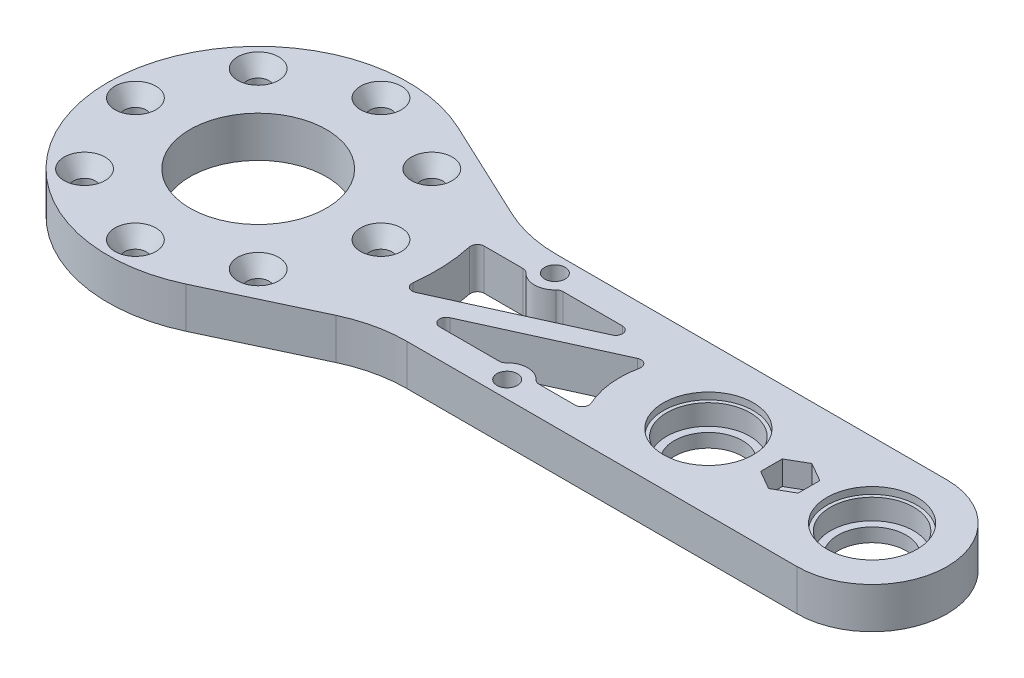
from build123d import *

# Parameters (mm, degrees)
SKETCH_1_R               = 1.6
SKETCH_1_R_2             = 10
SKETCH_1_R_3             = 5
EXTRUDE_1_DEPTH          = 6
FILLET_1_R               = 20
FILLET_2_R               = 1
CUT_EXTRUDE_START        = -6
SKETCH_2_R               = 6.6
CUT_EXTRUDE_2_DEPTH      = 5
SKETCH_3_R               = 1.5
CUT_EXTRUDE_3_DEPTH      = 34
EXTRUDE_2_DEPTH          = 6
FILLET_3_R               = 20
EXTRUDE_4_DEPTH          = 6
FILLET_5_R               = 1
EXTRUDE_5_DEPTH          = 6
FILLET_6_R               = 1
SKETCH_7_R               = 6.6
SKETCH_7_R_2             = 5
EXTRUDE_6_DEPTH          = 5
SKETCH_8_R               = 6.6
CUT_EXTRUDE_4_DEPTH      = 1
SKETCH_9_R               = 6.1
CUT_EXTRUDE_5_DEPTH      = 3
CUT_EXTRUDE_6_DEPTH      = 3.5
SKETCH_11_R              = 1.5
CUT_EXTRUDE_7_DEPTH      = 3.5
PATTERN_CIRCULAR_1_COUNT = 8


with BuildPart() as part:
    # 草图1 → 凸台-拉伸1 (new body)
    with BuildSketch(Plane(origin=(0, 0, 0), x_dir=(1, 0, 0), z_dir=(0, 1, 0))):
        with BuildLine():
            Line((-80.947441117, -11), (-10, -11))
            ThreePointArc((-10, -11), (1, 0), (-10, 11))
            Line((-10, 11), (-80.947441117, 11))
            ThreePointArc((-80.947441117, 11), (-122, 0), (-80.947441117, -11))
        make_face()
        with Locations(Location((-100, -18, 0), (0, 0, 270))):
            Circle(SKETCH_1_R, mode=Mode.SUBTRACT)
        with Locations(Location((-112.727922061, -12.727922061, 0), (0, 0, 270))):
            Circle(SKETCH_1_R, mode=Mode.SUBTRACT)
        with Locations(Location((-87.272077939, -12.727922061, 0), (0, 0, 270))):
            Circle(SKETCH_1_R, mode=Mode.SUBTRACT)
        with Locations(Location((-82, 0, 0), (0, 0, 270))):
            Circle(SKETCH_1_R, mode=Mode.SUBTRACT)
        with Locations(Location((-118, 0, 0), (0, 0, 270))):
            Circle(SKETCH_1_R, mode=Mode.SUBTRACT)
        with Locations(Location((-100, 0, 0), (0, 0, 270))):
            Circle(SKETCH_1_R_2, mode=Mode.SUBTRACT)
        with Locations(Location((-112.727922061, 12.727922061, 0), (0, 0, 270))):
            Circle(SKETCH_1_R, mode=Mode.SUBTRACT)
        with Locations(Location((-100, 18, 0), (0, 0, 270))):
            Circle(SKETCH_1_R, mode=Mode.SUBTRACT)
        with Locations(Location((-87.272077939, 12.727922061, 0), (0, 0, 270))):
            Circle(SKETCH_1_R, mode=Mode.SUBTRACT)
        with BuildLine():
            Line((-45.104161382, -6.76), (-71.264613993, -6.76))
            Line((-71.264613993, -6.76), (-46.143303622, 4.641139639))
            ThreePointArc((-46.143303622, 4.641139639), (-46.946337457, -1.179977312), (-45.104161382, -6.76))
        make_face(mode=Mode.SUBTRACT)
        with BuildLine():
            ThreePointArc((-74.469777695, -4.920137097), (-74.017146083, 0.944088105), (-74.894175974, 6.76))
            Line((-74.894175974, 6.76), (-48.733723364, 6.76))
            Line((-48.733723364, 6.76), (-74.469777695, -4.920137097))
        make_face(mode=Mode.SUBTRACT)
        with Locations(Location((-34, 0, 0), (0, 0, 270))):
            Circle(SKETCH_1_R_3, mode=Mode.SUBTRACT)
        with Locations(Location((-10, 0, 0), (0, 0, 270))):
            Circle(SKETCH_1_R_3, mode=Mode.SUBTRACT)
    extrude(amount=EXTRUDE_1_DEPTH)

    # 圆角1
    fillet_1_edges = [part.edges().sort_by_distance(p)[0] for p in [
        (-80.947441117, 3, -11),
        (-80.947441117, 3, 11),
    ]]
    fillet(fillet_1_edges, radius=FILLET_1_R)

    # 圆角2
    fillet_2_edges = [part.edges().sort_by_distance(p)[0] for p in [
        (-74.894175974, 3, -6.76),
        (-74.469777695, 3, 4.920137097),
        (-48.733723364, 3, -6.76),
        (-71.264613993, 3, 6.76),
        (-45.104161382, 3, 6.76),
        (-46.143303622, 3, -4.641139639),
    ]]
    fillet(fillet_2_edges, radius=FILLET_2_R)

    # 草图2 → 切除-拉伸2 (cut)
    with BuildSketch(Plane.XZ.offset(CUT_EXTRUDE_START)):
        with Locations(Location((-34, 0, 0), (0, 0, 90))):
            Circle(SKETCH_2_R)
        with Locations(Location((-10, 0, 0), (0, 0, 90))):
            Circle(SKETCH_2_R)
    extrude(amount=CUT_EXTRUDE_2_DEPTH, mode=Mode.SUBTRACT)

    # 草图3 → 切除-拉伸3 (cut)
    with BuildSketch(Plane(origin=(0, 6, 0), x_dir=(1, 0, 0), z_dir=(0, 1, 0))):
        with Locations(Location((-65, 8.5, 0), (0, 0, 270))):
            Circle(SKETCH_3_R)
        with Locations(Location((-55, -8.5, 0), (0, 0, 270))):
            Circle(SKETCH_3_R)
    extrude(amount=-CUT_EXTRUDE_3_DEPTH, mode=Mode.SUBTRACT)

    # 草图4 → 凸台-拉伸2 (add)
    with BuildSketch(Plane(origin=(0, 6, 0), x_dir=(1, 0, 0), z_dir=(0, 1, 0))):
        with BuildLine():
            Line((-71.662745369, 11), (-90.650436779, 19.914458757))
            ThreePointArc((-90.650436779, 19.914458757), (-87.764688053, 18.283794507), (-85.156676146, 16.238095238))
            ThreePointArc((-85.156676146, 16.238095238), (-78.900214014, 12.355455285), (-71.662745369, 11))
        make_face()
        with BuildLine():
            Line((-71.662745369, -11), (-90.650436779, -19.914458757))
            ThreePointArc((-90.650436779, -19.914458757), (-87.764688053, -18.283794507), (-85.156676146, -16.238095238))
            ThreePointArc((-85.156676146, -16.238095238), (-78.900214014, -12.355455285), (-71.662745369, -11))
        make_face()
    extrude(amount=-EXTRUDE_2_DEPTH)

    # 圆角3
    fillet_3_edges = [part.edges().sort_by_distance(p)[0] for p in [
        (-71.662745369, 3, -11),
        (-71.662745369, 3, 11),
    ]]
    fillet(fillet_3_edges, radius=FILLET_3_R)

    # 草图5 → 凸台-拉伸4 (add)
    with BuildSketch(Plane(origin=(0, 6, 0), x_dir=(1, 0, 0), z_dir=(0, 1, 0))):
        with BuildLine():
            Line((-57.443849423, -6.76), (-52.556150577, -6.76))
            ThreePointArc((-52.556150577, -6.76), (-55, -5.5), (-57.443849423, -6.76))
        make_face()
    extrude(amount=-EXTRUDE_4_DEPTH)

    # 圆角5
    fillet_5_edges = [part.edges().sort_by_distance(p)[0] for p in [
        (-57.443849423, 3, 6.76),
        (-52.556150577, 3, 6.76),
    ]]
    fillet(fillet_5_edges, radius=FILLET_5_R)

    # 草图6 → 凸台-拉伸5 (add)
    with BuildSketch(Plane(origin=(0, 6, 0), x_dir=(1, 0, 0), z_dir=(0, 1, 0))):
        with BuildLine():
            Line((-67.443849423, 6.76), (-62.556150577, 6.76))
            ThreePointArc((-62.556150577, 6.76), (-65, 5.5), (-67.443849423, 6.76))
        make_face()
    extrude(amount=-EXTRUDE_5_DEPTH)

    # 圆角6
    fillet_6_edges = [part.edges().sort_by_distance(p)[0] for p in [
        (-62.556150577, 3, -6.76),
        (-67.443849423, 3, -6.76),
    ]]
    fillet(fillet_6_edges, radius=FILLET_6_R)

    # 草图7 → 凸台-拉伸6 (add)
    # profile 1 of 2: a face of its own
    with BuildSketch(Plane(origin=(0, 6, 0), x_dir=(1, 0, 0), z_dir=(0, 1, 0))):
        with Locations((-10, 0)):
            Circle(SKETCH_7_R)
        with Locations(Location((-10, 0, 0), (0, 0, 270))):
            Circle(SKETCH_7_R_2, mode=Mode.SUBTRACT)
    # profile 2 of 2: a face of its own
    with BuildSketch(Plane(origin=(0, 6, 0), x_dir=(1, 0, 0), z_dir=(0, 1, 0))):
        with Locations((-34, 0)):
            Circle(SKETCH_7_R)
        with Locations(Location((-34, 0, 0), (0, 0, 270))):
            Circle(SKETCH_7_R_2, mode=Mode.SUBTRACT)
    extrude(amount=-EXTRUDE_6_DEPTH)

    # 草图8 → 切除-拉伸4 (cut)
    with BuildSketch(Plane(origin=(0, 6, 0), x_dir=(1, 0, 0), z_dir=(0, 1, 0))):
        with Locations(Location((-34, 0, 0), (0, 0, 270))):
            Circle(SKETCH_8_R)
        with Locations(Location((-10, 0, 0), (0, 0, 270))):
            Circle(SKETCH_8_R)
    extrude(amount=-CUT_EXTRUDE_4_DEPTH, mode=Mode.SUBTRACT)

    # 草图9 → 切除-拉伸5 (cut)
    with BuildSketch(Plane(origin=(0, 5, 0), x_dir=(1, 0, 0), z_dir=(0, 1, 0))):
        with Locations(Location((-34, 0, 0), (0, 0, 270))):
            Circle(SKETCH_9_R)
        with Locations(Location((-10, 0, 0), (0, 0, 270))):
            Circle(SKETCH_9_R)
    extrude(amount=-CUT_EXTRUDE_5_DEPTH, mode=Mode.SUBTRACT)

    # 草图10 → 切除-拉伸6 (cut)
    with BuildSketch(Plane(origin=(0, 6, 0), x_dir=(1, 0, 0), z_dir=(0, 1, 0))):
        Polygon((-19.25, -1.58771324), (-19.25, 1.58771324), (-22, 3.175426481), (-24.75, 1.58771324), (-24.75, -1.58771324), (-22, -3.175426481), align=None)
    extrude(amount=-CUT_EXTRUDE_6_DEPTH, mode=Mode.SUBTRACT)

    # 草图11 → 切除-拉伸7 (cut)
    with BuildSketch(Plane(origin=(0, 2.5, 0), x_dir=(1, 0, 0), z_dir=(0, 1, 0))):
        with Locations(Location((-22, 0, 0), (0, 0, 270))):
            Circle(SKETCH_11_R)
    extrude(amount=-CUT_EXTRUDE_7_DEPTH, mode=Mode.SUBTRACT)

    # 草图15 → 切除-旋转1 (revolve, cut)
    with BuildSketch(Plane.ZY.offset(100), mode=Mode.PRIVATE) as cut_revolve_1_sk:
        Polygon((-21, 6), (-19.5, 3.5), (-19.5, 0), (-18, 0), (-18, 6), align=None)
    cut_revolve_1 = revolve(cut_revolve_1_sk.sketch.rotate(Axis((-100, 0, -18), (0, 1, 0)), 180), axis=Axis((-100, 0, -18), (0, 1, 0)), mode=Mode.SUBTRACT)

    # 阵列(圆周)1: 切除-旋转1 ×8 about axis
    pattern_circular_1_axis = Axis((-100, 0, 0), (0, 1, 0))
    for i in range(1, PATTERN_CIRCULAR_1_COUNT):
        add(cut_revolve_1.rotate(pattern_circular_1_axis, i * 360 / PATTERN_CIRCULAR_1_COUNT), mode=Mode.SUBTRACT)


solid = part.part
